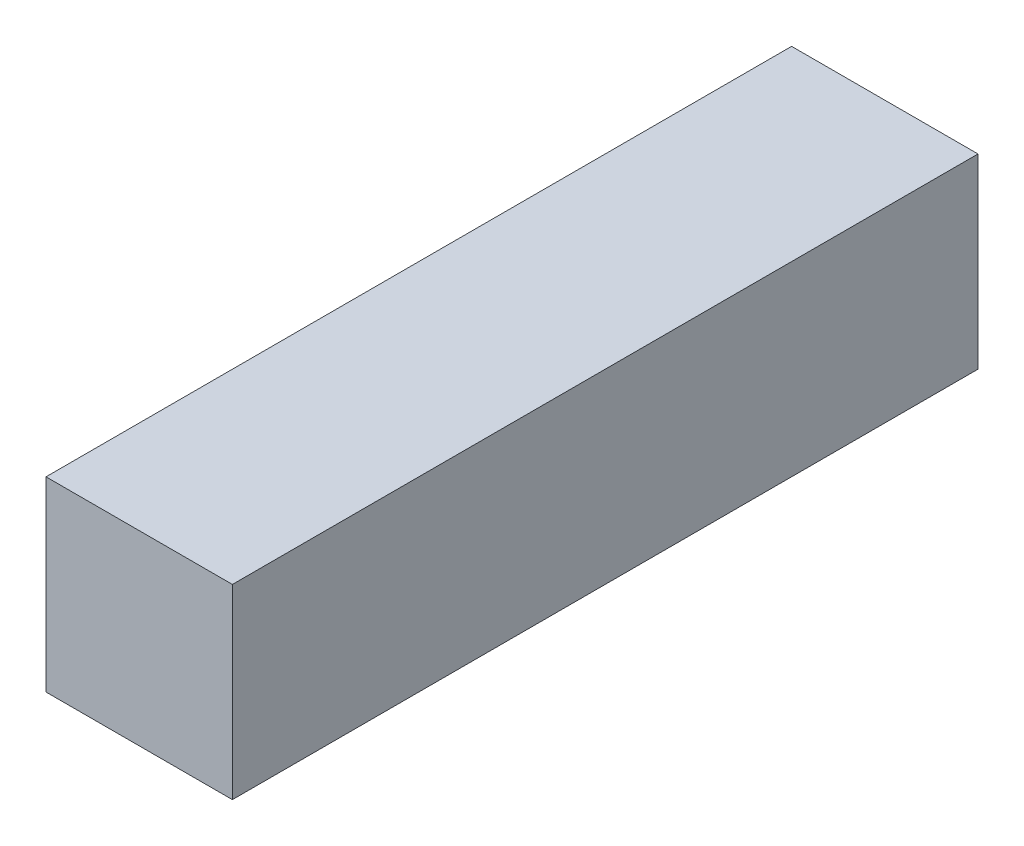
from build123d import *

# Parameters (mm, degrees)
SKETCH1_W           = 6.35
SKETCH1_H           = 6.35
BOSS_EXTRUDE1_DEPTH = 12.7


with BuildPart() as part:
    # Sketch1 → Boss-Extrude1 (new, symmetric)
    with BuildSketch(Plane.XY):
        Rectangle(SKETCH1_W, SKETCH1_H)
    extrude(amount=BOSS_EXTRUDE1_DEPTH, both=True)


solid = part.part
